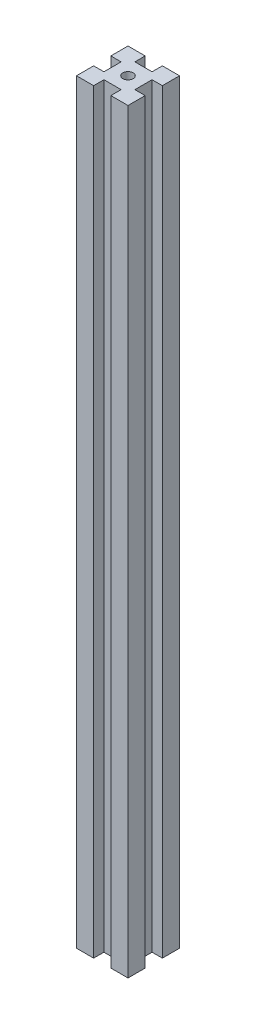
from build123d import *

# Parameters (mm, degrees)
SKETCH1_R           = 1.5
BOSS_EXTRUDE1_DEPTH = 220


with BuildPart() as part:
    # Sketch1 → Boss-Extrude1 (new body)
    with BuildSketch(Plane(origin=(0, 0, 0), x_dir=(1, 0, 0), z_dir=(0, 1, 0))):
        Polygon((-7.5, -7.5), (-2.5, -7.5), (-2.5, -4.5), (2.5, -4.5), (2.5, -7.5), (7.5, -7.5), (7.5, -2.5), (4.5, -2.5), (4.5, 2.5), (7.5, 2.5), (7.5, 7.5), (2.5, 7.5), (2.5, 4.5), (-2.5, 4.5), (-2.5, 7.5), (-7.5, 7.5), (-7.5, 2.5), (-4.5, 2.5), (-4.5, -2.5), (-7.5, -2.5), align=None)
        with Locations(Location((0, 0, 0), (0, 0, 270))):
            Circle(SKETCH1_R, mode=Mode.SUBTRACT)
    extrude(amount=BOSS_EXTRUDE1_DEPTH)


solid = part.part
